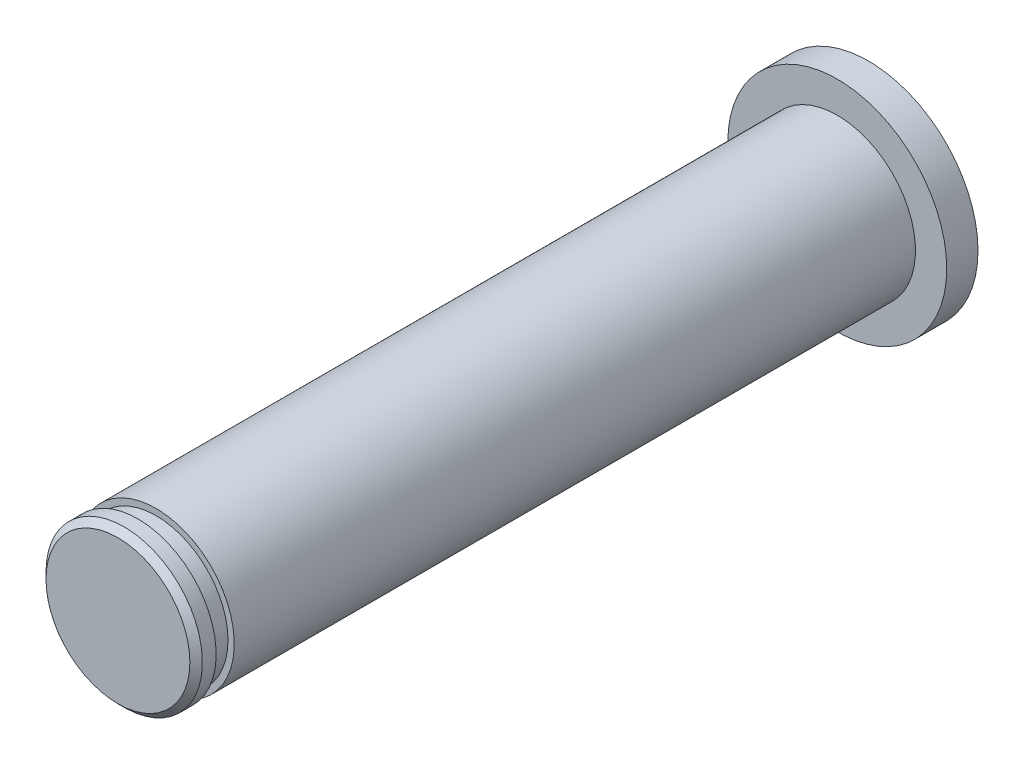
from build123d import *

# Parameters (mm, degrees)
SKETCH1_R           = 4.445
BOSS_EXTRUDE1_DEPTH = 1.27
SKETCH2_R           = 3.175
BOSS_EXTRUDE2_DEPTH = 29.21
CUT_EXTRUDE1_START  = -1.5494
SKETCH4_R           = 3.175
SKETCH4_R_2         = 2.921
CUT_EXTRUDE1_DEPTH  = 0.7366
CHAMFER1_SIZE       = 0.254


with BuildPart() as part:
    # Sketch1 → Boss-Extrude1 (new body)
    with BuildSketch(Plane.XY):
        Circle(SKETCH1_R)
    extrude(amount=BOSS_EXTRUDE1_DEPTH)

    # Sketch2 → Boss-Extrude2 (add)
    with BuildSketch(Plane.XY.offset(1.27)):
        with Locations(Location((0, 0, 0), (0, 0, 180))):
            Circle(SKETCH2_R)
    extrude(amount=BOSS_EXTRUDE2_DEPTH)

    # Sketch4 → Cut-Extrude1 (cut)
    with BuildSketch(Plane.XY.offset(30.48).offset(CUT_EXTRUDE1_START)):
        with Locations(Location((0, 0, 0), (0, 0, 180))):
            Circle(SKETCH4_R)
        Circle(SKETCH4_R_2, mode=Mode.SUBTRACT)
    extrude(amount=CUT_EXTRUDE1_DEPTH, mode=Mode.SUBTRACT)

    # Chamfer1
    chamfer1_edges = [part.edges().sort_by_distance(p)[0] for p in [
        (3.175, 0, 30.48),
    ]]
    chamfer(chamfer1_edges, length=CHAMFER1_SIZE)


solid = part.part
